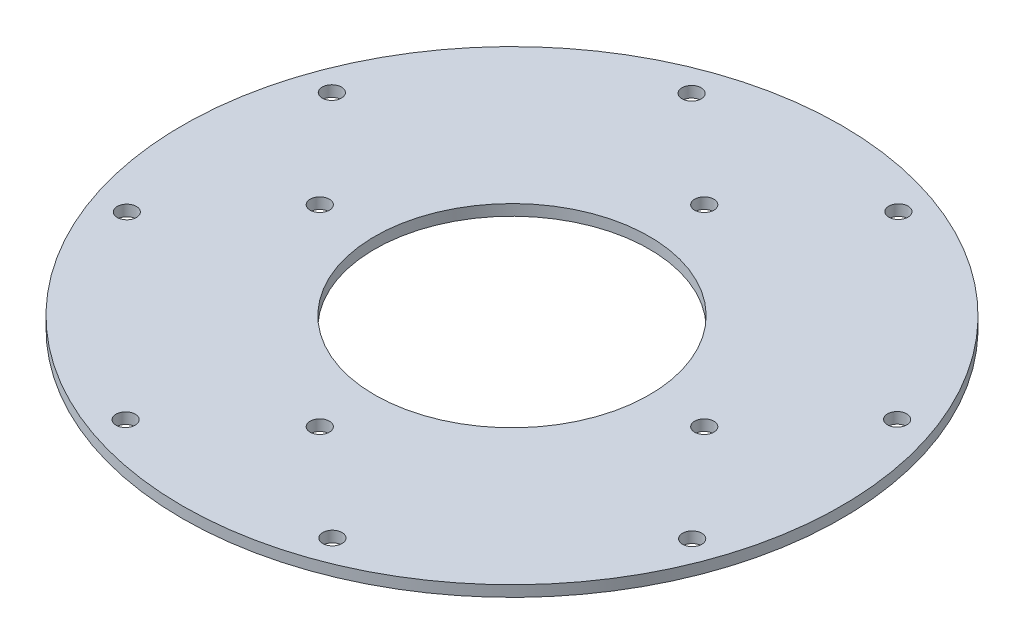
from build123d import *

# Parameters (mm, degrees)
IZIM1_R                     = 60
IZIM1_R_2                   = 1.75
Y_KSEKLIK_EKSTR_ZYON1_DEPTH = 2
IZIM2_R                     = 1.75
KES_EKSTR_ZYON1_DEPTH       = 10
IZIM3_R                     = 25
KES_EKSTR_ZYON2_DEPTH       = 10


with BuildPart() as part:
    # Çizim1 → Yükseklik-Ekstrüzyon1 (new body)
    with BuildSketch(Plane(origin=(0, 0, 0), x_dir=(1, 0, 0), z_dir=(0, 1, 0))):
        with Locations(Location((0, 0, 0), (0, 0, 270))):
            Circle(IZIM1_R)
        with Locations(Location((-51.576054603, 18.772148676, 0), (0, 0, 270))):
            Circle(IZIM1_R_2, mode=Mode.SUBTRACT)
        with Locations(Location((-18.712348032, 51.411753683, 0), (0, 0, 270))):
            Circle(IZIM1_R_2, mode=Mode.SUBTRACT)
        with Locations(Location((18.772148676, 51.576054603, 0), (0, 0, 270))):
            Circle(IZIM1_R_2, mode=Mode.SUBTRACT)
        with Locations(Location((51.411753683, 18.712348032, 0), (0, 0, 270))):
            Circle(IZIM1_R_2, mode=Mode.SUBTRACT)
        with Locations(Location((51.576054603, -18.772148676, 0), (0, 0, 270))):
            Circle(IZIM1_R_2, mode=Mode.SUBTRACT)
        with Locations(Location((18.712348032, -51.411753683, 0), (0, 0, 270))):
            Circle(IZIM1_R_2, mode=Mode.SUBTRACT)
        with Locations(Location((-18.772148676, -51.576054603, 0), (0, 0, 270))):
            Circle(IZIM1_R_2, mode=Mode.SUBTRACT)
        with Locations(Location((-51.411753683, -18.712348032, 0), (0, 0, 270))):
            Circle(IZIM1_R_2, mode=Mode.SUBTRACT)
    extrude(amount=Y_KSEKLIK_EKSTR_ZYON1_DEPTH)

    # Çizim2 → Kes-Ekstrüzyon1 (cut)
    with BuildSketch(Plane(origin=(0, 2, 0), x_dir=(1, 0, 0), z_dir=(0, 1, 0))):
        with Locations(Location((0, 35, 0), (0, 0, 270))):
            Circle(IZIM2_R)
        with Locations(Location((35, 0, 0), (0, 0, 270))):
            Circle(IZIM2_R)
        with Locations(Location((0, -35, 0), (0, 0, 270))):
            Circle(IZIM2_R)
        with Locations(Location((-35, 0, 0), (0, 0, 270))):
            Circle(IZIM2_R)
    extrude(amount=-KES_EKSTR_ZYON1_DEPTH, mode=Mode.SUBTRACT)

    # Çizim3 → Kes-Ekstrüzyon2 (cut)
    with BuildSketch(Plane(origin=(0, 2, 0), x_dir=(1, 0, 0), z_dir=(0, 1, 0))):
        with Locations(Location((0, 0, 0), (0, 0, 270))):
            Circle(IZIM3_R)
    extrude(amount=-KES_EKSTR_ZYON2_DEPTH, mode=Mode.SUBTRACT)


solid = part.part
